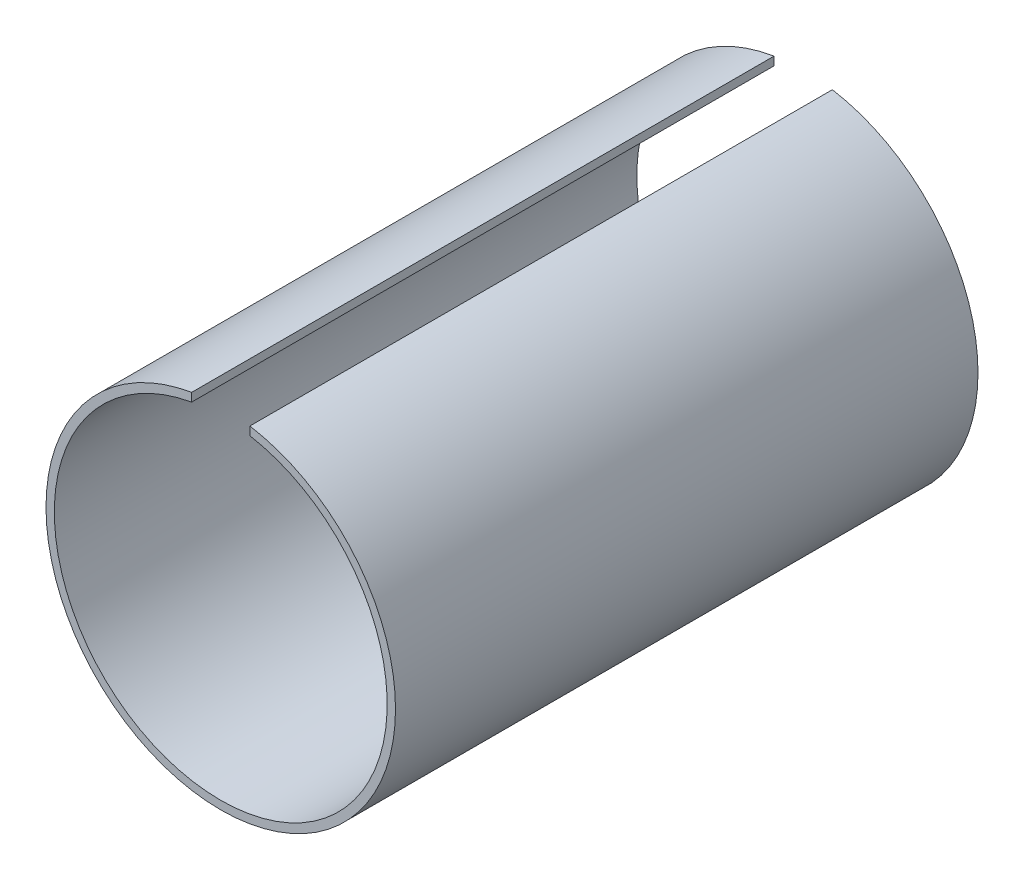
from build123d import *

# Parameters (mm, degrees)
SKETCH_1_R          = 21
SKETCH_1_R_2        = 20
EXTRUDE_1_DEPTH     = 35
SKETCH_2_W          = 7
SKETCH_2_H          = 27.364811352
CUT_EXTRUDE_1_DEPTH = 77.039463438


with BuildPart() as part:
    # 草图1 → 拉伸-薄壁1 (new, symmetric)
    with BuildSketch(Plane.XY):
        Circle(SKETCH_1_R)
        Circle(SKETCH_1_R_2, mode=Mode.SUBTRACT)
    extrude(amount=EXTRUDE_1_DEPTH, both=True)

    # 草图2 → 切除-拉伸-薄壁1 (cut, through all)
    with BuildSketch(Plane.XY.offset(35)):
        with Locations((0, 13.682405676)):
            Rectangle(SKETCH_2_W, SKETCH_2_H)
    extrude(amount=-CUT_EXTRUDE_1_DEPTH, mode=Mode.SUBTRACT)


solid = part.part
